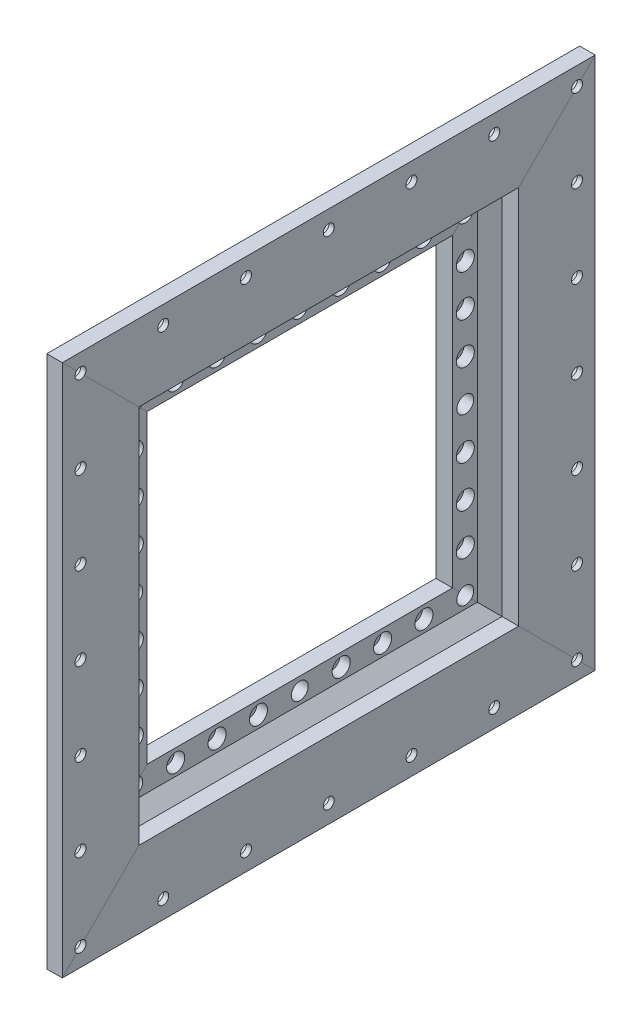
from build123d import *

# Parameters (mm, degrees)
FREE_START                                           = -9.2645
WALL_SCREW_HOLES_R                                   = 3.3782
WALL_SCREW_HOLES_R_2                                 = 5.1945
FREE_FIT_THROUGH_HOLES_DEPTH                         = 10.5345
WALL_SCREWS_CBORE_FOR_1_4_SOCKET_HEAD_CA_D           = 6.7564
WALL_SCREWS_CBORE_FOR_1_4_SOCKET_HEAD_CA_CBORE_D     = 11.1125
WALL_SCREWS_CBORE_FOR_1_4_SOCKET_HEAD_CA_CBORE_DEPTH = 6.35
CBORE_FOR_1_4_SOCKET_HEAD_CAP_SCREW1_D               = 6.7564
CBORE_FOR_1_4_SOCKET_HEAD_CAP_SCREW1_CBORE_D         = 11.1125
CBORE_FOR_1_4_SOCKET_HEAD_CAP_SCREW1_CBORE_DEPTH     = 6.35
OPTICAL_TABLE_CB_PATTERN_COUNT                       = 7
OPTICAL_TABLE_CB_PATTERN_PITCH                       = 50.8
OPTICAL_TABLE_CB_PATTERN_COUNT_DIR2                  = 7
OPTICAL_TABLE_CB_PATTERN_PITCH_DIR2                  = 50.8


with BuildPart() as part:
    # Frame: sweep along a path in Boundary
    with BuildLine(Plane.ZY) as frame_path:
        Line((0, 0), (-263.65, 0))
        Line((-263.65, 0), (-263.65, 263.65))
        Line((-263.65, 263.65), (0, 263.65))
        Line((0, 263.65), (0, 0))
    # Leg Sketch → Frame (sweep)
    with BuildSketch(Plane.XY):
        Polygon((19.05, 15.24), (8.89, 15.24), (1.27, 22.86), (1.27, 38.1), (-8.89, 38.1), (-8.89, 25.4), (-15.24, 19.05), (-15.24, 15.24), (0, 0), (9.525, 0), (9.525, -31.75), (19.05, -31.75), align=None)
    sweep(path=frame_path.line, transition=Transition.RIGHT)

    # Wall Screw Holes → Free Fit Through Holes (cut)
    with BuildSketch(Plane(origin=(0, 0, 0), x_dir=(0, 0, -1), z_dir=(1, 0, 0)).offset(FREE_START)):
        with Locations(Location((30.225, 55.63, 0), (0, 0, 180))):
            Circle(WALL_SCREW_HOLES_R)
        with Locations(Location((55.63, 30.23, 0), (0, 0, 180))):
            Circle(WALL_SCREW_HOLES_R)
        with Locations(Location((30.225, 81.03, 0), (0, 0, 180))):
            Circle(WALL_SCREW_HOLES_R)
        with Locations(Location((30.225, 106.43, 0), (0, 0, 180))):
            Circle(WALL_SCREW_HOLES_R)
        with Locations(Location((30.225, 157.23, 0), (0, 0, 180))):
            Circle(WALL_SCREW_HOLES_R)
        with Locations(Location((30.225, 182.63, 0), (0, 0, 180))):
            Circle(WALL_SCREW_HOLES_R)
        with Locations(Location((30.225, 208.03, 0), (0, 0, 180))):
            Circle(WALL_SCREW_HOLES_R)
        with Locations(Location((55.63, 233.43, 0), (0, 0, 180))):
            Circle(WALL_SCREW_HOLES_R)
        with Locations(Location((81.03, 233.43, 0), (0, 0, 180))):
            Circle(WALL_SCREW_HOLES_R)
        with Locations(Location((81.03, 30.23, 0), (0, 0, 180))):
            Circle(WALL_SCREW_HOLES_R)
        with Locations(Location((106.43, 233.43, 0), (0, 0, 180))):
            Circle(WALL_SCREW_HOLES_R)
        with Locations(Location((106.43, 30.23, 0), (0, 0, 180))):
            Circle(WALL_SCREW_HOLES_R)
        with Locations(Location((157.23, 233.43, 0), (0, 0, 180))):
            Circle(WALL_SCREW_HOLES_R)
        with Locations(Location((157.23, 30.23, 0), (0, 0, 180))):
            Circle(WALL_SCREW_HOLES_R)
        with Locations(Location((182.63, 233.43, 0), (0, 0, 180))):
            Circle(WALL_SCREW_HOLES_R)
        with Locations(Location((182.63, 30.23, 0), (0, 0, 180))):
            Circle(WALL_SCREW_HOLES_R)
        with Locations(Location((208.03, 233.43, 0), (0, 0, 180))):
            Circle(WALL_SCREW_HOLES_R)
        with Locations(Location((208.03, 30.23, 0), (0, 0, 180))):
            Circle(WALL_SCREW_HOLES_R)
        with Locations(Location((233.425, 81.03, 0), (0, 0, 180))):
            Circle(WALL_SCREW_HOLES_R)
        with Locations(Location((233.425, 55.63, 0), (0, 0, 180))):
            Circle(WALL_SCREW_HOLES_R)
        with Locations(Location((233.425, 106.43, 0), (0, 0, 180))):
            Circle(WALL_SCREW_HOLES_R)
        with Locations(Location((233.425, 157.23, 0), (0, 0, 180))):
            Circle(WALL_SCREW_HOLES_R)
        with Locations(Location((233.425, 182.63, 0), (0, 0, 180))):
            Circle(WALL_SCREW_HOLES_R)
        with Locations(Location((233.425, 208.03, 0), (0, 0, 180))):
            Circle(WALL_SCREW_HOLES_R)
        with Locations(Location((30.225, 233.43, 0), (0, 0, 135.038997245))):
            Circle(WALL_SCREW_HOLES_R_2)
        with Locations(Location((233.425, 233.43, 0), (0, 0, 225.038997245))):
            Circle(WALL_SCREW_HOLES_R_2)
        with Locations(Location((233.425, 30.23, 0), (0, 0, 135.038997245))):
            Circle(WALL_SCREW_HOLES_R_2)
        with Locations(Location((30.225, 30.23, 0), (0, 0, 225.038997245))):
            Circle(WALL_SCREW_HOLES_R_2)
        with Locations(Location((131.825, 233.43, 0), (0, 0, 180))):
            Circle(WALL_SCREW_HOLES_R_2)
        with Locations(Location((233.425, 131.825, 0), (0, 0, 180))):
            Circle(WALL_SCREW_HOLES_R_2)
        with Locations(Location((131.825, 30.23, 0), (0, 0, 180))):
            Circle(WALL_SCREW_HOLES_R_2)
        with Locations(Location((30.225, 131.825, 0), (0, 0, 180))):
            Circle(WALL_SCREW_HOLES_R_2)
    extrude(amount=FREE_FIT_THROUGH_HOLES_DEPTH, mode=Mode.SUBTRACT)

    # Wall Screws CBORE for 1/4 Socket Head Cap Screw1 (through all)
    with Locations(Plane(origin=(1.27, 208.03, -30.225), x_dir=(0, 0, 1), z_dir=(1, 0, 0))):
        with Locations((0, 0), (0, 25.4), (0, 50.8), (0, 101.6), (0, 127), (0, 152.4), (-25.405, 177.8), (-50.805, 177.8), (-177.805, 177.8), (-152.405, 177.8), (-127.005, 177.8), (-76.205, 177.8), (-203.2, 152.4), (-203.2, 127), (-203.2, 50.8), (-203.2, 25.4), (-203.2, 0), (-177.805, -25.4), (-152.405, -25.4), (-127.005, -25.4), (-76.205, -25.4), (-50.805, -25.4), (-25.405, -25.4), (-203.2, 101.6)):
            CounterBoreHole(WALL_SCREWS_CBORE_FOR_1_4_SOCKET_HEAD_CA_D / 2, WALL_SCREWS_CBORE_FOR_1_4_SOCKET_HEAD_CA_CBORE_D / 2, WALL_SCREWS_CBORE_FOR_1_4_SOCKET_HEAD_CA_CBORE_DEPTH)

    # CBORE for 1/4 Socket Head Cap Screw1 (through all)
    with Locations(Plane(origin=(9.525, 284.225, -284.225), x_dir=(0, 0, -1), z_dir=(-1, 0, 0))):
        with Locations((0, 0)):
            cbore_for_1_4_socket_head_cap_screw1 = CounterBoreHole(CBORE_FOR_1_4_SOCKET_HEAD_CAP_SCREW1_D / 2, CBORE_FOR_1_4_SOCKET_HEAD_CAP_SCREW1_CBORE_D / 2, CBORE_FOR_1_4_SOCKET_HEAD_CAP_SCREW1_CBORE_DEPTH)

    # Optical Table CB Pattern: CBORE for 1_4 Socket Head Cap Screw1 7 × 7, 25 skipped
    with Locations(*[(0, -j * OPTICAL_TABLE_CB_PATTERN_PITCH_DIR2, i * OPTICAL_TABLE_CB_PATTERN_PITCH) for i in range(OPTICAL_TABLE_CB_PATTERN_COUNT) for j in range(OPTICAL_TABLE_CB_PATTERN_COUNT_DIR2) if (i, j) not in ((0, 0), (1, 1), (1, 2), (1, 3), (1, 4), (1, 5), (2, 1), (2, 2), (2, 3), (2, 4), (2, 5), (3, 1), (3, 2), (3, 3), (3, 4), (3, 5), (4, 1), (4, 2), (4, 3), (4, 4), (4, 5), (5, 1), (5, 2), (5, 3), (5, 4), (5, 5))]):
        add(cbore_for_1_4_socket_head_cap_screw1, mode=Mode.SUBTRACT)


solid = part.part
